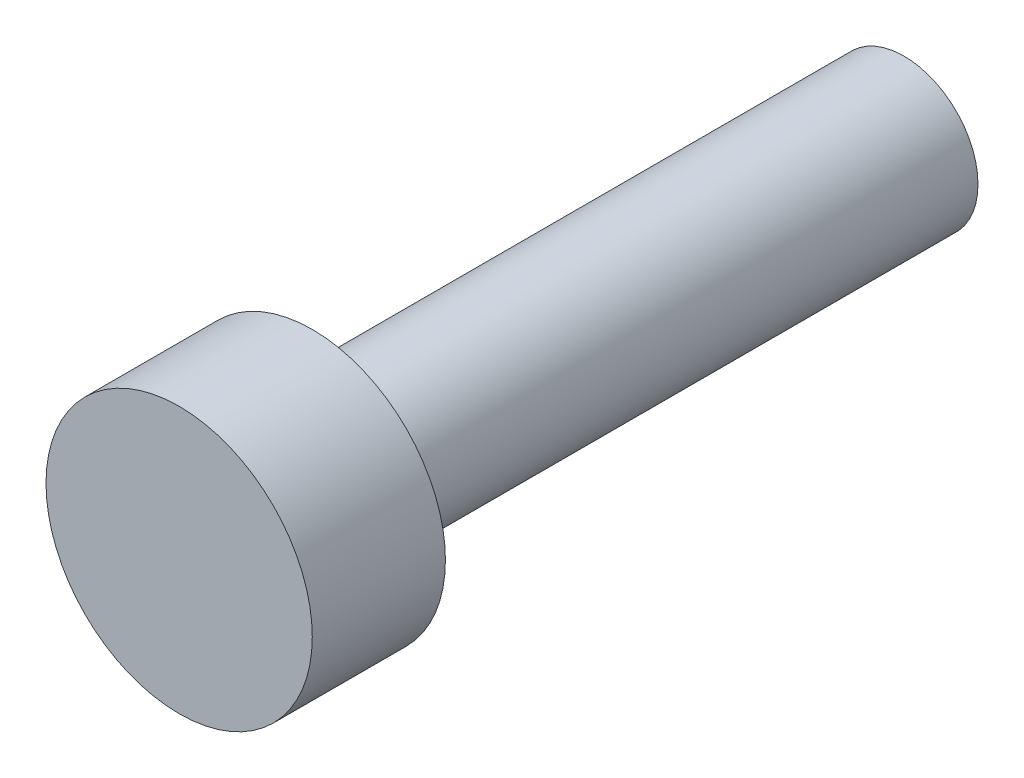
from build123d import *

# Parameters (mm, degrees)
SKETCH1_R           = 1
BOSS_EXTRUDE1_DEPTH = 8
SKETCH2_R           = 1.8
BOSS_EXTRUDE2_DEPTH = 1.8


with BuildPart() as part:
    # Sketch1 → Boss-Extrude1 (new body)
    with BuildSketch(Plane.XY):
        Circle(SKETCH1_R)
    extrude(amount=BOSS_EXTRUDE1_DEPTH)

    # Sketch2 → Boss-Extrude2 (add)
    with BuildSketch(Plane.XY.offset(8)):
        Circle(SKETCH2_R)
    extrude(amount=BOSS_EXTRUDE2_DEPTH)


solid = part.part
